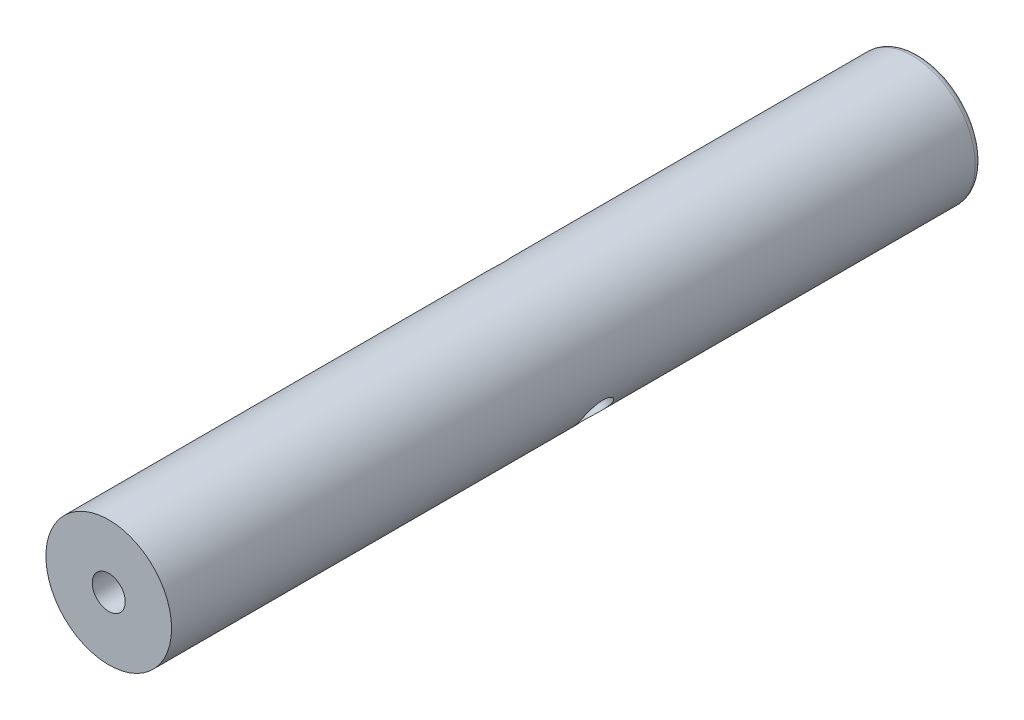
from build123d import *

# Parameters (mm, degrees)
ESBO_O1_R                                      = 4.7625
RESSALTO_EXTRUS_O1_DEPTH                       = 61.4
FURO_ROSCADO_DE_M5X0_81_D                      = 4.2
FURO_ROSCADO_DE_M5X0_81_DEPTH                  = 14
FURO_ROSCADO_DE_M5X0_81_TIP                    = 1.2618073
FILETE1_R                                      = 0.5
BROCA_DE_ROSQUEAR_PARA_TARRAXA_DE_M3X0_5_D     = 2.5
BROCA_DE_ROSQUEAR_PARA_TARRAXA_DE_M3X0_5_DEPTH = 5
BROCA_DE_ROSQUEAR_PARA_TARRAXA_DE_M3X0_5_TIP   = 0.751075774
BROCA_DE_ROSQUEAR_PARA_TARRAXA_DE_M3_2_D       = 2.5
BROCA_DE_ROSQUEAR_PARA_TARRAXA_DE_M3_2_DEPTH   = 10
BROCA_DE_ROSQUEAR_PARA_TARRAXA_DE_M3_2_TIP     = 0.751075774


with BuildPart() as part:
    # Esboço1 → Ressalto-extrusão1 (new body)
    with BuildSketch(Plane.XY):
        with Locations((240.708388302, 2.596082859)):
            Circle(ESBO_O1_R)
    extrude(amount=RESSALTO_EXTRUS_O1_DEPTH)

    # Furo roscado de M5x0.81
    with Locations(Plane(origin=(0, 0, 0), x_dir=(-1, 0, 0), z_dir=(0, 0, -1))):
        with Locations((-240.708388302, 2.596082859)):
            Hole(FURO_ROSCADO_DE_M5X0_81_D / 2, depth=FURO_ROSCADO_DE_M5X0_81_DEPTH)
            with Locations((0, 0, -(FURO_ROSCADO_DE_M5X0_81_DEPTH + FURO_ROSCADO_DE_M5X0_81_TIP / 2))):  # 118° drill point
                Cone(0, FURO_ROSCADO_DE_M5X0_81_D / 2, FURO_ROSCADO_DE_M5X0_81_TIP, mode=Mode.SUBTRACT)

    # Filete1
    filete1_edges = [part.edges().sort_by_distance(p)[0] for p in [
        (235.945888302, 2.596082859, 0),
    ]]
    fillet(filete1_edges, radius=FILETE1_R)

    # Broca de rosquear para tarraxa de M3x0.5
    with Locations(Plane.XY.offset(61.4)):
        with Locations((240.708388302, 2.596082859)):
            Hole(BROCA_DE_ROSQUEAR_PARA_TARRAXA_DE_M3X0_5_D / 2, depth=BROCA_DE_ROSQUEAR_PARA_TARRAXA_DE_M3X0_5_DEPTH)
            with Locations((0, 0, -(BROCA_DE_ROSQUEAR_PARA_TARRAXA_DE_M3X0_5_DEPTH + BROCA_DE_ROSQUEAR_PARA_TARRAXA_DE_M3X0_5_TIP / 2))):  # 118° drill point
                Cone(0, BROCA_DE_ROSQUEAR_PARA_TARRAXA_DE_M3X0_5_D / 2, BROCA_DE_ROSQUEAR_PARA_TARRAXA_DE_M3X0_5_TIP, mode=Mode.SUBTRACT)

    # Broca de rosquear para tarraxa de M3 2
    with Locations(Plane(origin=(236.819403783, 5.345120084, 28.431873204), x_dir=(-0.577225664074, -0.81658467579, 0), z_dir=(-0.81658467579, 0.577225664074, 0))):
        with Locations((0, 0)):
            Hole(BROCA_DE_ROSQUEAR_PARA_TARRAXA_DE_M3_2_D / 2, depth=BROCA_DE_ROSQUEAR_PARA_TARRAXA_DE_M3_2_DEPTH)
            with Locations((0, 0, -(BROCA_DE_ROSQUEAR_PARA_TARRAXA_DE_M3_2_DEPTH + BROCA_DE_ROSQUEAR_PARA_TARRAXA_DE_M3_2_TIP / 2))):  # 118° drill point
                Cone(0, BROCA_DE_ROSQUEAR_PARA_TARRAXA_DE_M3_2_D / 2, BROCA_DE_ROSQUEAR_PARA_TARRAXA_DE_M3_2_TIP, mode=Mode.SUBTRACT)


solid = part.part
